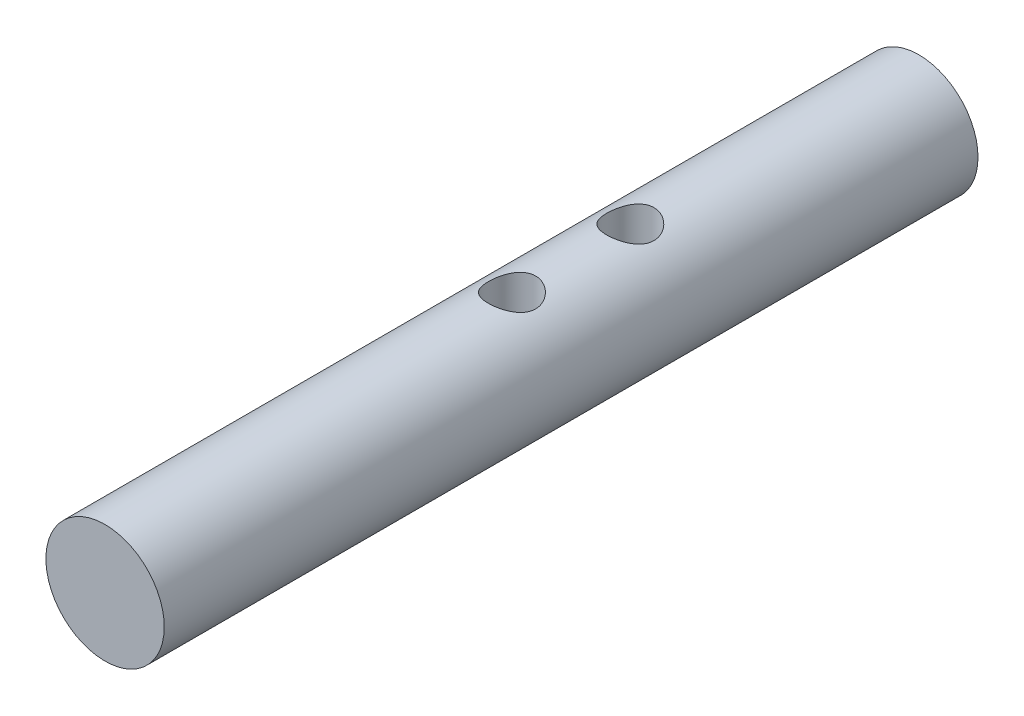
from build123d import *

# Parameters (mm, degrees)
SKETCH_305_R          = 4
EXTRUDE_350_DEPTH     = 55
SKETCH_434_R          = 1.6
CUT_EXTRUDE_541_DEPTH = 56.722526863


with BuildPart() as part:
    # Sketch 305 → Extrude 350 (new body)
    with BuildSketch(Plane.XY):
        Circle(SKETCH_305_R)
    extrude(amount=EXTRUDE_350_DEPTH)

    # Sketch 434 → Cut-Extrude 541 (cut, through all)
    with BuildSketch(Plane(origin=(0, 4, 0), x_dir=(1, 0, 0), z_dir=(0, 1, 0))):
        with Locations((0, -19.5)):
            Circle(SKETCH_434_R)
        with Locations((0, -27.5)):
            Circle(SKETCH_434_R)
    extrude(amount=-CUT_EXTRUDE_541_DEPTH, mode=Mode.SUBTRACT)


solid = part.part
